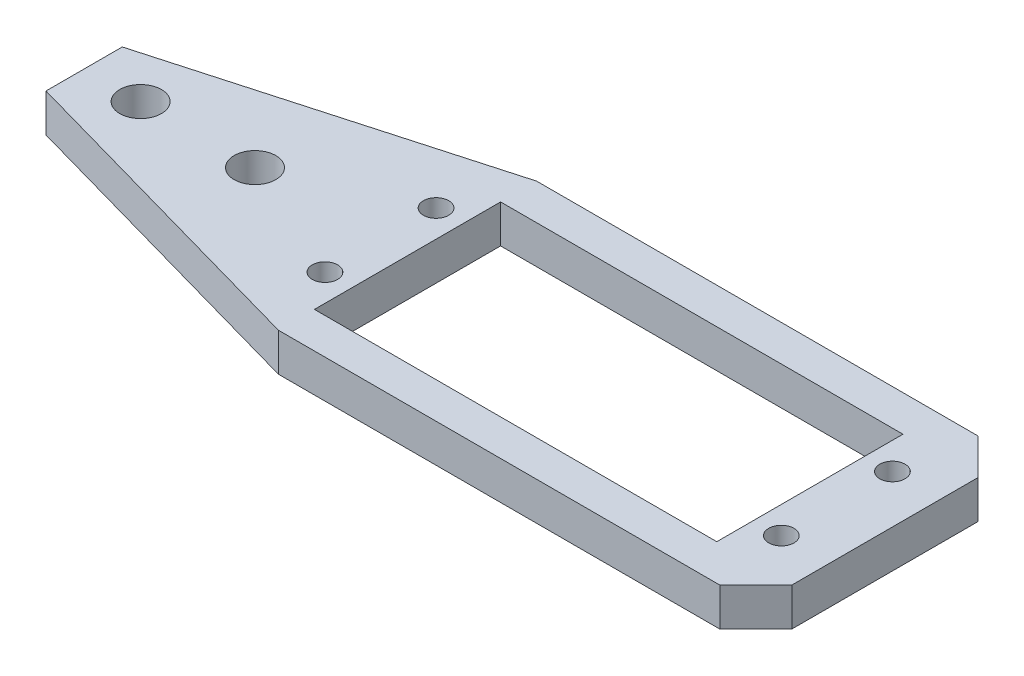
from build123d import *

# Parameters (mm, degrees)
SKETCH1_R           = 2.1082
SKETCH1_R_2         = 3.475
SKETCH1_W           = 67
SKETCH1_H           = 31
BOSS_EXTRUDE1_DEPTH = 6.35


with BuildPart() as part:
    # Sketch1 → Boss-Extrude1 (new body)
    with BuildSketch(Plane(origin=(0, 0, 0), x_dir=(1, 0, 0), z_dir=(0, 1, 0))):
        Polygon((60.675, -21.5), (-12.825, -21.5), (-66.675, -6.35), (-66.675, 6.35), (-12.825, 21.5), (60.675, 21.5), (66.675, 15.5), (66.675, -15.5), align=None)
        with Locations(Location((58.675, 9.25, 0), (0, 0, 270))):
            Circle(SKETCH1_R, mode=Mode.SUBTRACT)
        with Locations(Location((58.675, -9.25, 0), (0, 0, 90))):
            Circle(SKETCH1_R, mode=Mode.SUBTRACT)
        with Locations(Location((-17.325, -9.25, 0), (0, 0, 270))):
            Circle(SKETCH1_R, mode=Mode.SUBTRACT)
        with Locations(Location((-17.325, 9.25, 0), (0, 0, 90))):
            Circle(SKETCH1_R, mode=Mode.SUBTRACT)
        with Locations(Location((-57.275, 0, 0), (0, 0, 270))):
            Circle(SKETCH1_R_2, mode=Mode.SUBTRACT)
        with Locations(Location((-38.225, 0, 0), (0, 0, 270))):
            Circle(SKETCH1_R_2, mode=Mode.SUBTRACT)
        with Locations((20.675, 0)):
            Rectangle(SKETCH1_W, SKETCH1_H, mode=Mode.SUBTRACT)
    extrude(amount=BOSS_EXTRUDE1_DEPTH)


solid = part.part
